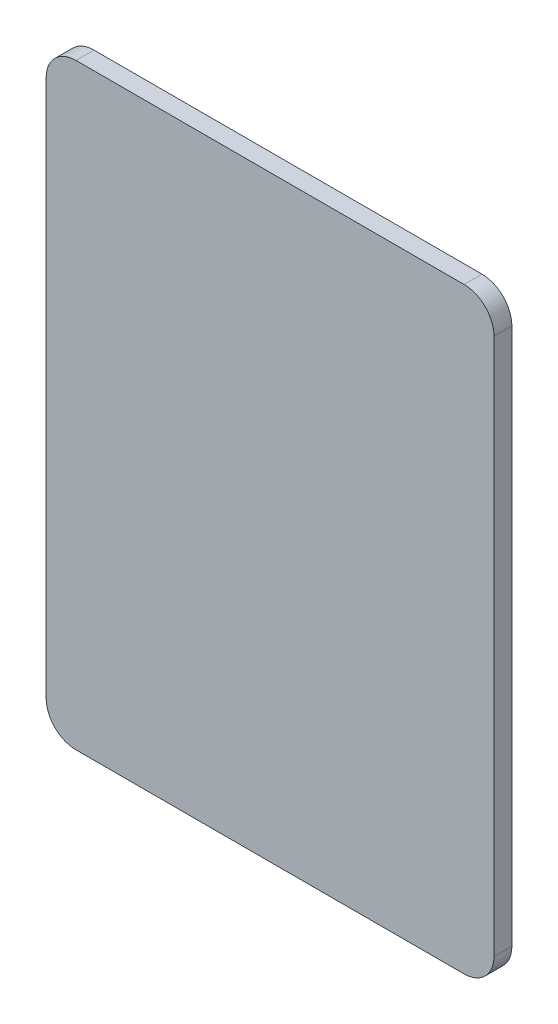
from build123d import *

# Parameters (mm, degrees)
SKETCH2_W           = 150
SKETCH2_H           = 200
BOSS_EXTRUDE1_DEPTH = 6
FILLET1_R           = 10


with BuildPart() as part:
    # Sketch2 → Boss-Extrude1 (new body)
    with BuildSketch(Plane.XY):
        Rectangle(SKETCH2_W, SKETCH2_H)
    extrude(amount=BOSS_EXTRUDE1_DEPTH)

    # Fillet1
    fillet1_edges = [part.edges().sort_by_distance(p)[0] for p in [
        (-75, 100, 3),
        (75, 100, 3),
        (75, -100, 3),
        (-75, -100, 3),
    ]]
    fillet(fillet1_edges, radius=FILLET1_R)


solid = part.part
